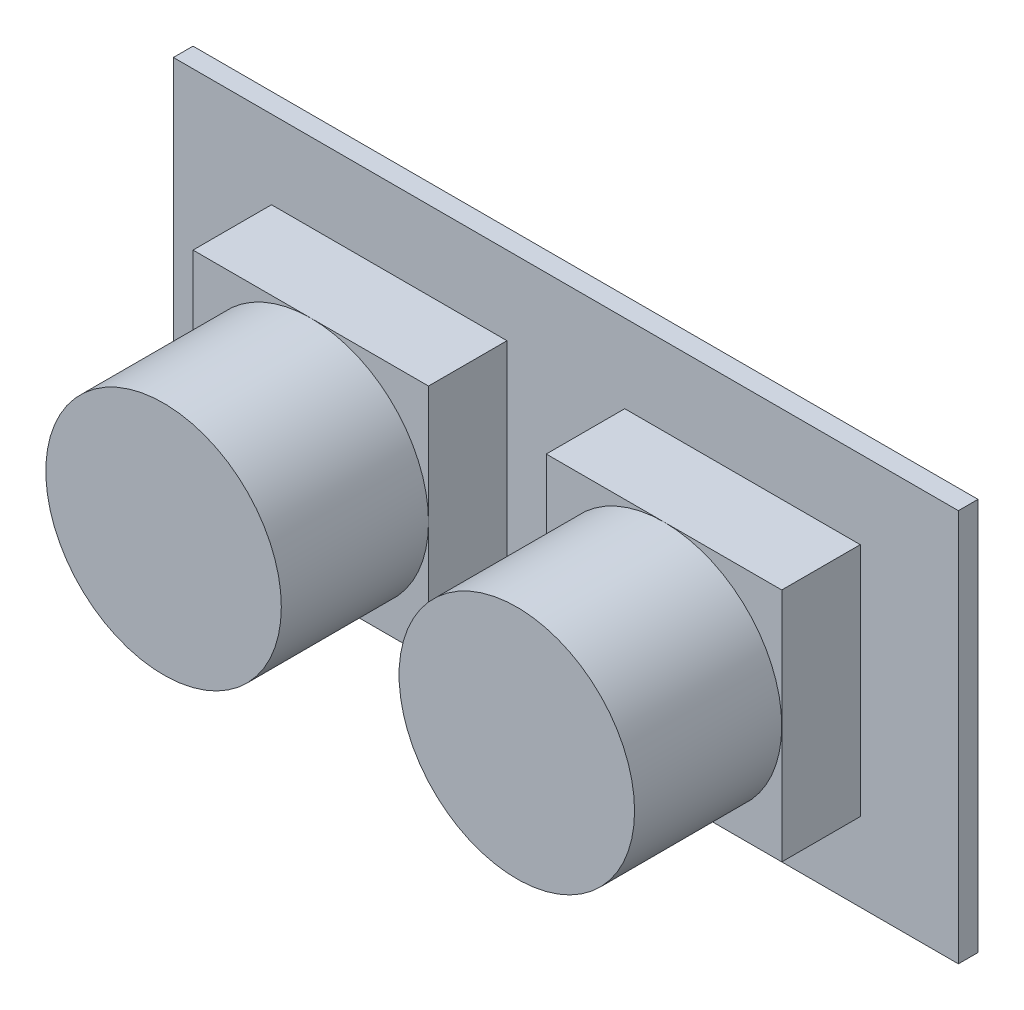
from build123d import *

# Parameters (mm, degrees)
ESQUISSE_1_W       = 4
ESQUISSE_1_H       = 2
BOSS_EXTRU_2_DEPTH = 0.1
ESQUISSE_2_W       = 1.2
ESQUISSE_2_H       = 1.2
BOSS_EXTRU_3_DEPTH = 0.5
ESQUISSE_3_R       = 0.6
BOSS_EXTRU_4_DEPTH = 1.25


with BuildPart() as part:
    # Esquisse 1 → Boss.-Extru.2 (new body)
    with BuildSketch(Plane.XY):
        with Locations((2, 1)):
            Rectangle(ESQUISSE_1_W, ESQUISSE_1_H)
    extrude(amount=BOSS_EXTRU_2_DEPTH)

    # Esquisse 2 → Boss.-Extru.3 (add)
    with BuildSketch(Plane.XY):
        with Locations((1.1, 1)):
            Rectangle(ESQUISSE_2_W, ESQUISSE_2_H)
        with Locations((2.9, 1)):
            Rectangle(ESQUISSE_2_W, ESQUISSE_2_H)
    extrude(amount=BOSS_EXTRU_3_DEPTH)

    # Esquisse 3 → Boss.-Extru.4 (add)
    with BuildSketch(Plane.XY):
        with Locations((1.1, 1)):
            Circle(ESQUISSE_3_R)
        with Locations((2.9, 1)):
            Circle(ESQUISSE_3_R)
    extrude(amount=BOSS_EXTRU_4_DEPTH)


solid = part.part
